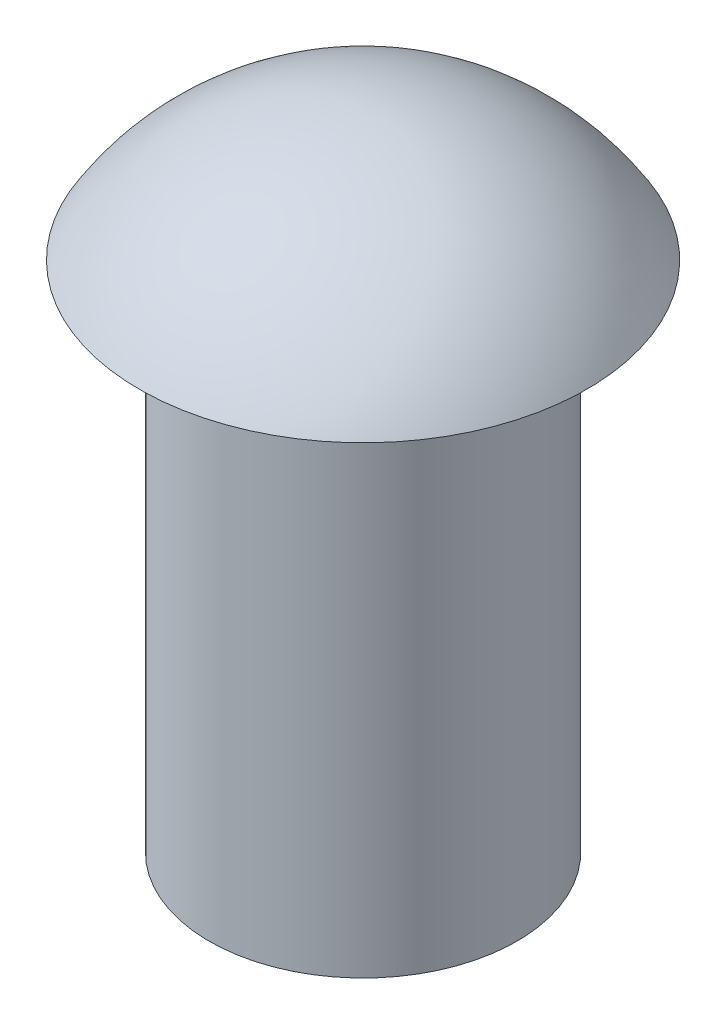
from build123d import *


with BuildPart() as part:
    # Sketch1 → Revolve1 (revolve)
    with BuildSketch(Plane.XY):
        with BuildLine():
            Line((0, 6.85777949), (0, 0))
            Line((0, 0), (-1.65, 0))
            Line((-1.65, 0), (-1.65, 5.5))
            Line((-1.65, 5.5), (-2.4, 5.5))
            ThreePointArc((-2.4, 5.5), (-1.378728141, 6.494808155), (0, 6.85777949))
        make_face()
    revolve(axis=Axis((0, 6.85777949, 0), (0, -1, 0)))


solid = part.part
